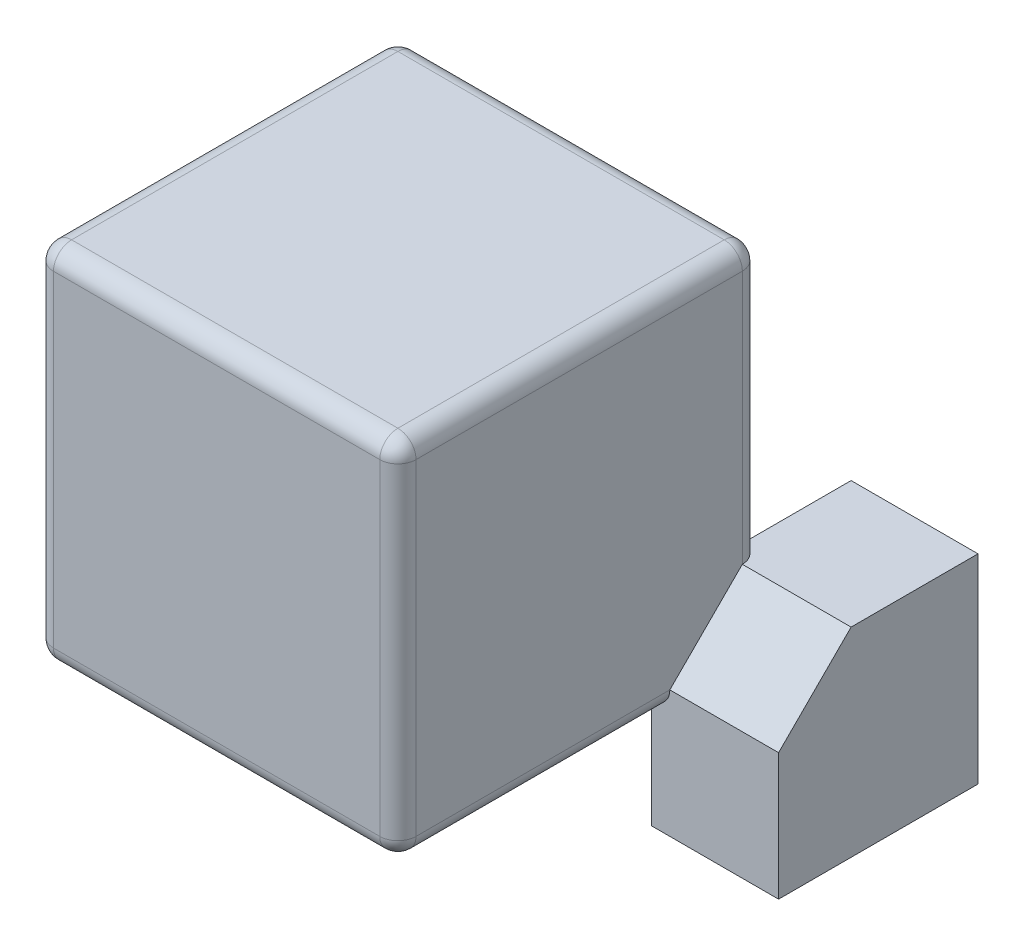
from build123d import *

# Parameters (mm, degrees)
SKETCH1_W                = 10
SKETCH1_H                = 10
BASE_EXTRUDE_DEPTH       = 10
BOSS_EXTRUDE1_DEPTH      = 5
BOSS_EXTRUDE1_DEPTH_BACK = 0.5
SKETCH3_W                = 5.5
SKETCH3_H                = 5.5
FILLET2_R                = 0.5
CHAMFER4_SIZE            = 2


with BuildPart() as part:
    # Sketch1 → Base-Extrude (new body)
    with BuildSketch(Plane.XY):
        Rectangle(SKETCH1_W, SKETCH1_H)
    extrude(amount=BASE_EXTRUDE_DEPTH)

    # Sketch3 → Boss-Extrude1 (add, two sides: drawn at the far end of the back side and taken through both)
    with BuildSketch(Plane(origin=(3, 0, 0), x_dir=(0, 0, -1), z_dir=(1, 0, 0)).offset(-BOSS_EXTRUDE1_DEPTH_BACK)):
        with Locations((0.25, -5.25)):
            Rectangle(SKETCH3_W, SKETCH3_H)
    extrude(amount=BOSS_EXTRUDE1_DEPTH + BOSS_EXTRUDE1_DEPTH_BACK)

    # Fillet2
    fillet2_edges = [part.edges().sort_by_distance(p)[0] for p in [
        (-5, 5, 5),
        (5, 5, 5),
        (0, 5, 0),
        (0, 5, 10),
        (-5, -5, 5),
        (-5, 0, 0),
        (-5, 0, 10),
        (5, 1.25, 0),
        (5, -5, 6.25),
        (5, 0, 10),
        (-1.25, -5, 0),
        (0, -5, 10),
    ]]
    fillet(fillet2_edges, radius=FILLET2_R)

    # Chamfer4
    chamfer4_edges = [part.edges().sort_by_distance(p)[0] for p in [
        (2.5, -2.5, -1.5),
        (2.5, -6.5, 2.5),
        (6.5, -2.5, 2.5),
    ]]
    chamfer(chamfer4_edges, length=CHAMFER4_SIZE)


solid = part.part
